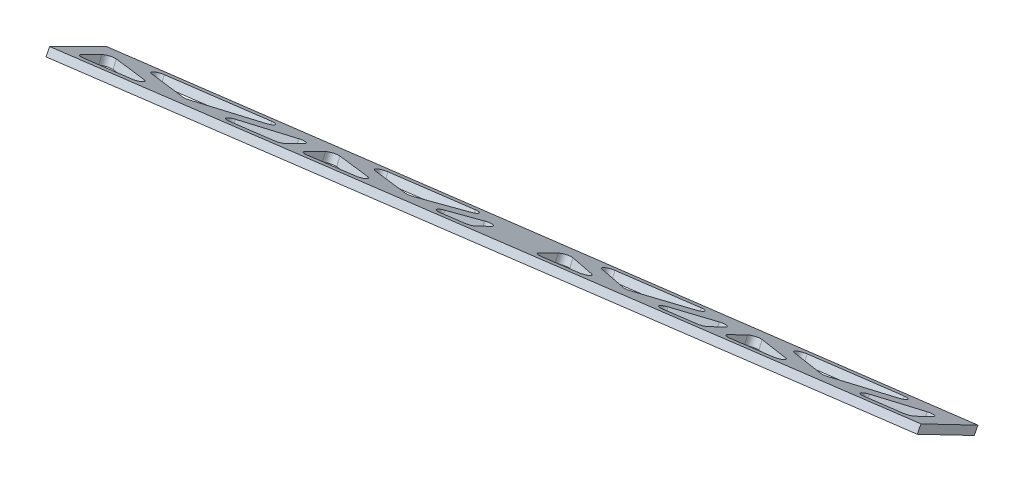
from build123d import *

# Parameters (mm, degrees)
CUT_EXTRUDE1_DEPTH      = 348.15001592
CUT_EXTRUDE1_DEPTH_BACK = 348.15001592
FILLET1_R               = 2.54


with BuildPart() as part:
    # Sketch1<4> → Loft3 section 0
    with BuildSketch(Plane(origin=(0, 0, 0), x_dir=(0, 0, -1), z_dir=(1, 0, 0))):
        with BuildLine():
            Line((146.053031758, -42.941582115), (168.594795862, -54.647515272))
            Line((168.594795862, -54.647515272), (170.058037507, -51.829794759))
            Line((170.058037507, -51.829794759), (147.516273403, -40.123861602))
            Line((147.516273403, -40.123861602), (146.053031758, -42.941582115))
        make_face()
    # Sketch2<4> → Loft3 section 1
    with BuildSketch(Plane(origin=(-301.244, 0, 0), x_dir=(0, 0, -1), z_dir=(1, 0, 0))):
        with BuildLine():
            Line((125.828368959, -54.427320521), (103.140917658, -43.006306842))
            Line((103.140917658, -43.006306842), (104.568544368, -40.17037543))
            Line((104.568544368, -40.17037543), (127.255995669, -51.591389108))
            Line((127.255995669, -51.591389108), (125.828368959, -54.427320521))
        make_face()
    loft()

    # Sketch3 → Cut-Extrude1 (cut, two sides: drawn at the far end of the back side and taken through both)
    with BuildSketch(Plane(origin=(-2.088531267, 28.612784475, -14.858612705), x_dir=(0.9979084132764692, 0.057369347464419615, -0.029791889559852704), z_dir=(-0.0646436285494539, 0.8856148051022275, -0.45989957411559323)).offset(-CUT_EXTRUDE1_DEPTH_BACK)):
        Polygon((-293.44993503, 115.290950046), (-293.437214288, 130.909344128), (-264.280543286, 118.971592888), align=None)
        Polygon((-209.545217662, 144.92540256), (-161.675769383, 150.966280016), (-181.047284261, 133.257361315), align=None)
        Polygon((-222.30042402, 124.268714845), (-250.764804664, 120.677031488), (-222.30042402, 139.508802177), align=None)
        Polygon((-134.877534747, 150.77057696), (-134.877534747, 135.299881846), (-110.907832924, 138.324419081), align=None)
        Polygon((-156.216534162, 132.60729106), (-174.930134494, 130.245977539), (-156.216534162, 147.35344843), align=None)
        Polygon((-287.029214558, 135.147321823), (-229.410973685, 142.418446619), (-258.226377305, 123.354442379), align=None)
        Polygon((-129.334803294, 155.047543118), (-82.065784612, 161.012649456), (-105.700293953, 142.775432399), align=None)
        Polygon((-4.257091232, 151.781788795), (-30.211161805, 148.506860578), (-4.257091232, 166.937592798), align=None)
        Polygon((-69.502442128, 159.10626395), (-69.502442128, 143.549020835), (-42.859712466, 146.910845212), align=None)
        Polygon((-75.852442128, 157.786399831), (-75.852442128, 142.747767169), (-99.151772658, 139.80781851), align=None)
        Polygon((-215.95042402, 140.686281161), (-215.95042402, 125.069968511), (-186.794642287, 128.748894019), align=None)
        Polygon((-63.522631135, 163.352699777), (-10.925846423, 169.990142707), (-37.224238779, 151.314897683), align=None)
    extrude(amount=CUT_EXTRUDE1_DEPTH + CUT_EXTRUDE1_DEPTH_BACK, mode=Mode.SUBTRACT)

    # Fillet1
    fillet1_edges = [part.edges().sort_by_distance(p)[0] for p in [
        (-39.130548255, -44.68804373, -147.294734032),
        (-107.459990626, -44.727374209, -137.652062892),
        (-182.645638077, -44.714798919, -126.933655987),
        (-259.659351162, -44.632777713, -115.817666791),
        (-294.804589244, -43.00101792, -107.579117522),
        (-252.211296848, -42.999399407, -113.648980298),
        (-217.471819613, -42.998085844, -118.599612215),
        (-176.539785008, -42.996545638, -124.432725288),
        (-136.573357631, -42.995049603, -130.128228147),
        (-100.924458329, -42.993721715, -135.208448794),
        (-71.338917006, -42.992624359, -139.424595506),
        (-32.132169635, -42.991176679, -145.011827958),
        (-288.412504414, -51.575419034, -125.500539953),
        (-211.091241939, -51.6273954, -136.491464074),
        (-131.049285819, -51.681231962, -147.869107892),
        (-65.375330922, -51.725428328, -157.204385222),
        (-71.341911227, -50.12136933, -153.252500082),
        (-136.579058191, -50.046831028, -143.898577817),
        (-217.48098276, -50.069539802, -132.523827398),
        (-294.80431785, -50.028045071, -121.528748887),
        (-223.817360536, -49.895844931, -131.28724691),
        (-157.872727487, -49.705764807, -140.225282066),
        (-77.678406788, -49.880440696, -151.890394881),
        (-6.234192357, -49.971489575, -162.154653179),
        (-12.889007684, -51.760765274, -164.665087842),
        (-83.879540638, -51.712973447, -154.574090544),
        (-163.322329555, -51.659521143, -143.281625878),
        (-230.915275459, -51.614066591, -133.673554418),
        (-265.697956139, -42.999910938, -111.727030969),
        (-223.808157571, -42.998324997, -117.696637519),
        (-188.37876644, -42.996990285, -122.745584643),
        (-157.866446684, -42.995845688, -127.093810583),
        (-112.655225873, -42.994157995, -133.536731692),
        (-77.675255291, -42.992859023, -138.521623141),
        (-44.753507719, -42.991641899, -143.213200488),
        (-6.233937469, -42.990224491, -148.702502856),
    ]]
    fillet(fillet1_edges, radius=FILLET1_R)


solid = part.part
